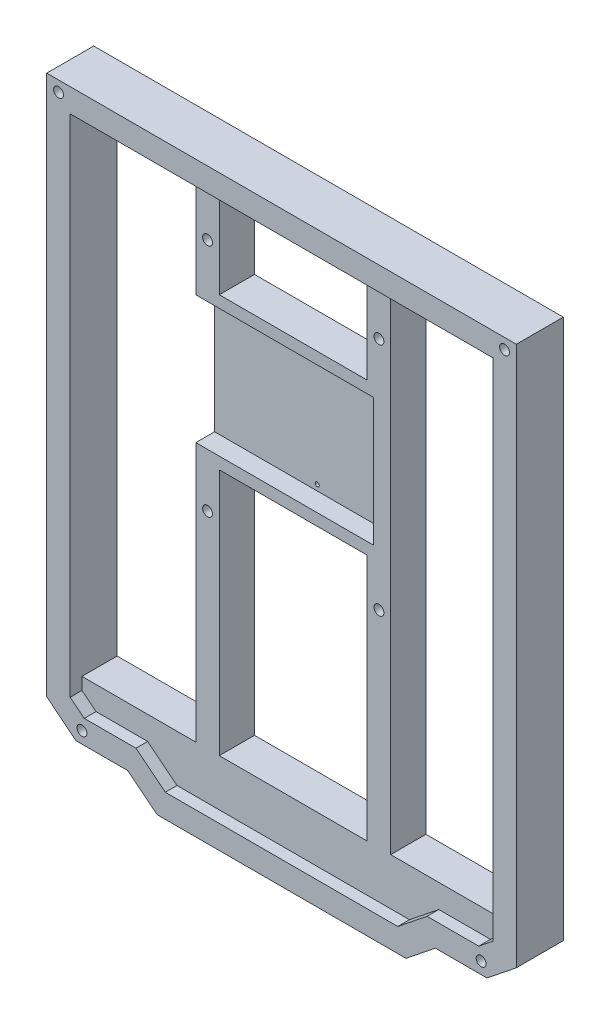
from build123d import *

# Parameters (mm, degrees)
ESQUISSE1_W                           = 200
ESQUISSE1_H                           = 30
BOSS_EXTRU_1_DEPTH                    = 20
ESQUISSE2_W                           = 83
ESQUISSE2_H                           = 20
BOSS_EXTRU_2_DEPTH                    = 170
ESQUISSE3_W                           = 10
ESQUISSE3_H                           = 20
BOSS_EXTRU_3_DEPTH                    = 40
ESQUISSE4_W                           = 10
ESQUISSE4_H                           = 20
BOSS_EXTRU_4_DEPTH                    = 40
ESQUISSE5_W                           = 10
ESQUISSE5_H                           = 20
BOSS_EXTRU_5_DEPTH                    = 210
ESQUISSE6_W                           = 10
ESQUISSE6_H                           = 20
BOSS_EXTRU_6_DEPTH                    = 210
ENL_V_MAT_EXTRU_1_DEPTH               = 5
ESQUISSE8_W                           = 200
ESQUISSE8_H                           = 20
BOSS_EXTRU_7_DEPTH                    = 10
ESQUISSE9_W                           = 46.979991994
ESQUISSE9_H                           = 10
ENL_V_MAT_EXTRU_2_DEPTH               = 176.144775689
ESQUISSE10_W                          = 46.979991993
ESQUISSE10_H                          = 10
ENL_V_MAT_EXTRU_3_DEPTH               = 176.144775689
ESQUISSE11_W                          = 63
ESQUISSE11_H                          = 105.446
ENL_V_MAT_EXTRU_4_DEPTH               = 175.644474436
ESQUISSE12_W                          = 8
ESQUISSE12_H                          = 54.5
ENL_V_MAT_EXTRU_5_DEPTH               = 75.65
D_POUILLE1_ANGLE                      = 51.317812547
D_POUILLE2_ANGLE                      = 51.317812547
DIAM_TRE_DU_PER_AGE_4_2_4_2_1_D       = 4.2
DIAM_TRE_DU_PER_AGE_4_2_4_2_2_D       = 4.2
DIAM_TRE_DU_PER_AGE_4_2_4_2_2_DEPTH   = 20
DIAM_TRE_DU_PER_AGE_1_75_1_75_1_D     = 1.75
DIAM_TRE_DU_PER_AGE_1_75_1_75_1_DEPTH = 20
CHANFREIN1_SIZE                       = 12.489995997
CHANFREIN1_SIZE2                      = 10
CHANFREIN2_SIZE                       = 10
CHANFREIN2_SIZE2                      = 12.489995997
CHANFREIN3_SIZE                       = 4.803844614
CHANFREIN3_SIZE2                      = 6
CHANFREIN4_SIZE                       = 6
CHANFREIN4_SIZE2                      = 4.803844614


with BuildPart() as part:
    # Esquisse1 → Boss.-Extru.1 (new body)
    with BuildSketch(Plane.XY.offset(106.902665531)):
        with Locations((-11.355880004, -118.699515481)):
            Rectangle(ESQUISSE1_W, ESQUISSE1_H)
    extrude(amount=-BOSS_EXTRU_1_DEPTH)

    # Esquisse2 → Boss.-Extru.2 (add)
    with BuildSketch(Plane(origin=(0, -103.699515481, 0), x_dir=(-1, 0, 0), z_dir=(0, 1, 0))):
        with Locations((11.355880004, 96.902665531)):
            Rectangle(ESQUISSE2_W, ESQUISSE2_H)
    extrude(amount=BOSS_EXTRU_2_DEPTH)

    # Esquisse3 → Boss.-Extru.3 (add)
    with BuildSketch(Plane(origin=(0, 66.300484519, 0), x_dir=(-1, 0, 0), z_dir=(0, 1, 0))):
        with Locations((-25.144119996, 96.902665531)):
            Rectangle(ESQUISSE3_W, ESQUISSE3_H)
    extrude(amount=BOSS_EXTRU_3_DEPTH)

    # Esquisse4 → Boss.-Extru.4 (add)
    with BuildSketch(Plane(origin=(0, 66.300484519, 0), x_dir=(-1, 0, 0), z_dir=(0, 1, 0))):
        with Locations((47.855880004, 96.902665531)):
            Rectangle(ESQUISSE4_W, ESQUISSE4_H)
    extrude(amount=BOSS_EXTRU_4_DEPTH)

    # Esquisse5 → Boss.-Extru.5 (add)
    with BuildSketch(Plane(origin=(0, -103.699515481, 0), x_dir=(-1, 0, 0), z_dir=(0, 1, 0))):
        with Locations((-83.644119996, 96.902665531)):
            Rectangle(ESQUISSE5_W, ESQUISSE5_H)
    extrude(amount=BOSS_EXTRU_5_DEPTH)

    # Esquisse6 → Boss.-Extru.6 (add)
    with BuildSketch(Plane(origin=(0, -103.699515481, 0), x_dir=(-1, 0, 0), z_dir=(0, 1, 0))):
        with Locations((106.355880004, 96.902665531)):
            Rectangle(ESQUISSE6_W, ESQUISSE6_H)
    extrude(amount=BOSS_EXTRU_6_DEPTH)

    # Esquisse7 → Enlèv. mat.-Extru.1 (cut)
    with BuildSketch(Plane.XY.offset(106.902665531)):
        Polygon((-42.855880004, 106.300484519), (-52.855880004, 106.300484519), (-52.855880004, -103.699515481), (-101.355880004, -103.699515481), (-101.355880004, -113.699515481), (-60.865884007, -113.699515481), (-60.865884007, -123.699515481), (38.154124, -123.699515481), (38.154124, -113.699515481), (78.644119996, -113.699515481), (78.644119996, -103.699515481), (30.144119996, -103.699515481), (30.144119996, 106.300484519), (20.144119996, 106.300484519), (20.144119996, 66.300484519), (-42.855880004, 66.300484519), align=None)
    extrude(amount=-ENL_V_MAT_EXTRU_1_DEPTH, mode=Mode.SUBTRACT)

    # Esquisse8 → Boss.-Extru.7 (add)
    with BuildSketch(Plane(origin=(0, 106.300484519, 0), x_dir=(-1, 0, 0), z_dir=(0, 1, 0))):
        with Locations((11.355880004, 96.902665531)):
            Rectangle(ESQUISSE8_W, ESQUISSE8_H)
    extrude(amount=BOSS_EXTRU_7_DEPTH)

    # Esquisse9 → Enlèv. mat.-Extru.2 (cut, through all)
    with BuildSketch(Plane(origin=(0, 0, 86.902665531), x_dir=(-1, 0, 0), z_dir=(0, 0, -1))):
        with Locations((87.865884007, -128.699515481)):
            Rectangle(ESQUISSE9_W, ESQUISSE9_H)
    extrude(amount=-ENL_V_MAT_EXTRU_2_DEPTH, mode=Mode.SUBTRACT)

    # Esquisse10 → Enlèv. mat.-Extru.3 (cut, through all)
    with BuildSketch(Plane(origin=(0, 0, 86.902665531), x_dir=(-1, 0, 0), z_dir=(0, 0, -1))):
        with Locations((-65.154124, -128.699515481)):
            Rectangle(ESQUISSE10_W, ESQUISSE10_H)
    extrude(amount=-ENL_V_MAT_EXTRU_3_DEPTH, mode=Mode.SUBTRACT)

    # Esquisse11 → Enlèv. mat.-Extru.4 (cut, through all)
    with BuildSketch(Plane.XY.offset(101.902665531)):
        with Locations((-11.355880004, -50.976515481)):
            Rectangle(ESQUISSE11_W, ESQUISSE11_H)
    extrude(amount=-ENL_V_MAT_EXTRU_4_DEPTH, mode=Mode.SUBTRACT)

    # Esquisse12 → Enlèv. mat.-Extru.5 (cut)
    with BuildSketch(Plane.ZY.offset(52.855880004)):
        with Locations((97.902665531, 34.023484519)):
            Rectangle(ESQUISSE12_W, ESQUISSE12_H)
    extrude(amount=-ENL_V_MAT_EXTRU_5_DEPTH, mode=Mode.SUBTRACT)

    # Dépouille1
    d_pouille1_faces = [part.faces().sort_by_distance(p)[0] for p in [
        (38.154124, -118.699515481, 104.402665531),
        (-60.865884007, -118.699515481, 104.402665531),
    ]]
    draft(d_pouille1_faces, Plane(origin=(-60.865884007, -123.699515481, 101.902665531), x_dir=(0, 0, 1), z_dir=(0, 1, 0)), D_POUILLE1_ANGLE)

    # Dépouille2
    d_pouille2_faces = [part.faces().sort_by_distance(p)[0] for p in [
        (41.664128003, -128.699515481, 96.902665531),
        (-64.37588801, -128.699515481, 96.902665531),
    ]]
    draft(d_pouille2_faces, Plane(origin=(-111.355880004, -133.699515481, 86.902665531), x_dir=(-1, 0, 0), z_dir=(0, -1, 0)), D_POUILLE2_ANGLE)

    # Diamètre du perçage Ø4.2 (4.2)1 (through all)
    with Locations(Plane(origin=(0, 0, 86.902665531), x_dir=(-1, 0, 0), z_dir=(0, 0, -1))):
        with Locations((-73.644119996, -118.699515481), (96.355880004, -118.699515481), (106.330817189, 111.800484519), (-83.619057182, 111.800484519)):
            Hole(DIAM_TRE_DU_PER_AGE_4_2_4_2_1_D / 2)

    # Diamètre du perçage Ø4.2 (4.2)2
    with Locations(Plane(origin=(0, 0, 86.902665531), x_dir=(-1, 0, 0), z_dir=(0, 0, -1))):
        with Locations((47.855880004, -15.976515481), (-25.144119996, -15.976515481), (-25.144119996, 84.023484519), (47.855880004, 84.023484519)):
            Hole(DIAM_TRE_DU_PER_AGE_4_2_4_2_2_D / 2, depth=DIAM_TRE_DU_PER_AGE_4_2_4_2_2_DEPTH)

    # Diamètre du perçage Ø1.75 (1.75)1
    with Locations(Plane(origin=(0, 0, 86.902665531), x_dir=(-1, 0, 0), z_dir=(0, 0, -1))):
        with Locations((9.125880004, 9.253484519), (-20.564119996, 34.023484519), (9.125880004, 58.793484519)):
            Hole(DIAM_TRE_DU_PER_AGE_1_75_1_75_1_D / 2, depth=DIAM_TRE_DU_PER_AGE_1_75_1_75_1_DEPTH)

    # Chanfrein1
    chanfrein1_edges = [part.edges().sort_by_distance(p)[0] for p in [
        (88.644119996, -123.699515481, 96.902665531),
    ]]
    chanfrein1_side = [part.faces().sort_by_distance(p)[0] for p in [
        (71.399121998, -123.699515481, 96.902665531),
    ]]
    chamfer(chanfrein1_edges, length=CHANFREIN1_SIZE, length2=CHANFREIN1_SIZE2, reference=chanfrein1_side[0])

    # Chanfrein2
    chanfrein2_edges = [part.edges().sort_by_distance(p)[0] for p in [
        (-111.355880004, -123.699515481, 96.902665531),
    ]]
    chanfrein2_side = [part.faces().sort_by_distance(p)[0] for p in [
        (-111.355880004, -3.699515481, 96.902665531),
    ]]
    chamfer(chanfrein2_edges, length=CHANFREIN2_SIZE, length2=CHANFREIN2_SIZE2, reference=chanfrein2_side[0])

    # Chanfrein3
    chanfrein3_edges = [part.edges().sort_by_distance(p)[0] for p in [
        (-101.355880004, -113.699515481, 104.402665531),
    ]]
    chanfrein3_side = [part.faces().sort_by_distance(p)[0] for p in [
        (-101.355880004, 0.006366872, 96.990900825),
    ]]
    chamfer(chanfrein3_edges, length=CHANFREIN3_SIZE, length2=CHANFREIN3_SIZE2, reference=chanfrein3_side[0])

    # Chanfrein4
    chanfrein4_edges = [part.edges().sort_by_distance(p)[0] for p in [
        (78.644119996, -113.699515481, 104.402665531),
    ]]
    chanfrein4_side = [part.faces().sort_by_distance(p)[0] for p in [
        (64.644119996, -113.699515481, 104.402665531),
    ]]
    chamfer(chanfrein4_edges, length=CHANFREIN4_SIZE, length2=CHANFREIN4_SIZE2, reference=chanfrein4_side[0])


solid = part.part
